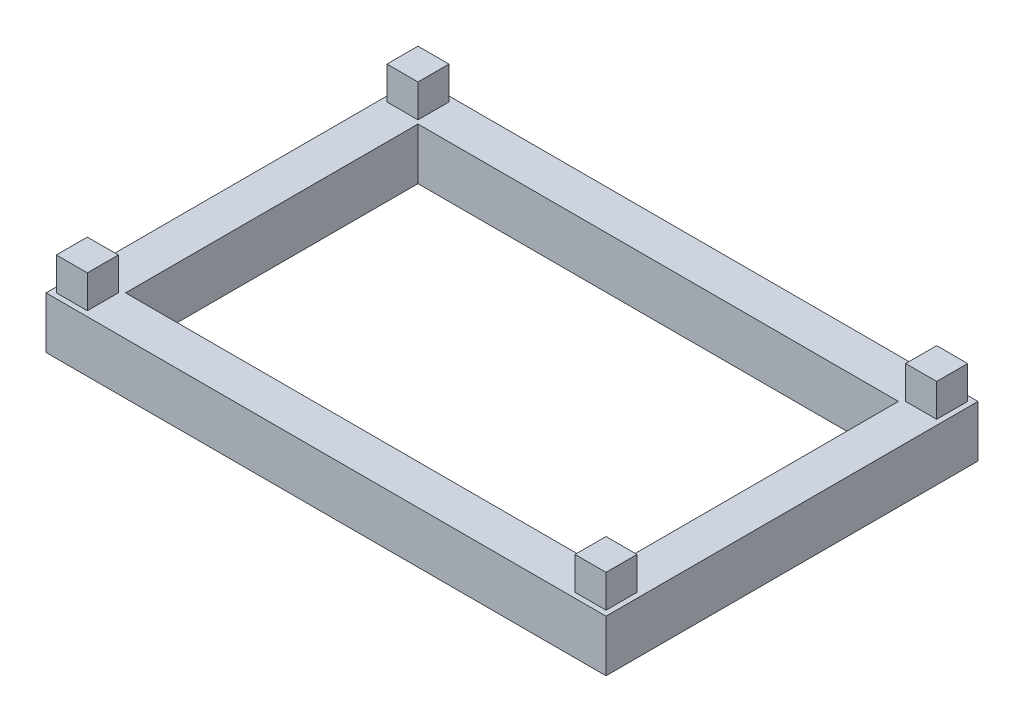
from build123d import *

# Parameters (mm, degrees)
SKETCH1_W           = 108.4
SKETCH1_H           = 72
BOSS_EXTRUDE1_DEPTH = 10
SKETCH2_W           = 93
SKETCH2_H           = 56.6
CUT_EXTRUDE1_DEPTH  = 131.516512365
SKETCH4_W           = 6
SKETCH4_H           = 6
BOSS_EXTRUDE2_DEPTH = 6.35
SKETCH5_W           = 6
SKETCH5_H           = 6
BOSS_EXTRUDE3_DEPTH = 6.35
SKETCH6_W           = 6
SKETCH6_H           = 6
BOSS_EXTRUDE4_DEPTH = 6.35
SKETCH7_W           = 6
SKETCH7_H           = 6
BOSS_EXTRUDE5_DEPTH = 6.35


with BuildPart() as part:
    # Sketch1 → Boss-Extrude1 (new body)
    with BuildSketch(Plane(origin=(0, 0, 0), x_dir=(1, 0, 0), z_dir=(0, 1, 0))):
        with Locations((54.2, 36)):
            Rectangle(SKETCH1_W, SKETCH1_H)
    extrude(amount=BOSS_EXTRUDE1_DEPTH)

    # Sketch2 → Cut-Extrude1 (cut, through all)
    with BuildSketch(Plane(origin=(0, 10, 0), x_dir=(1, 0, 0), z_dir=(0, 1, 0))):
        with Locations((54.2, 36)):
            Rectangle(SKETCH2_W, SKETCH2_H)
    extrude(amount=-CUT_EXTRUDE1_DEPTH, mode=Mode.SUBTRACT)

    # Sketch4 → Boss-Extrude2 (add)
    with BuildSketch(Plane(origin=(0, 10, 0), x_dir=(1, 0, 0), z_dir=(0, 1, 0))):
        with Locations((4, 4)):
            Rectangle(SKETCH4_W, SKETCH4_H)
    extrude(amount=BOSS_EXTRUDE2_DEPTH)

    # Sketch5 → Boss-Extrude3 (add)
    with BuildSketch(Plane(origin=(0, 10, 0), x_dir=(1, 0, 0), z_dir=(0, 1, 0))):
        with Locations((104.4, 4)):
            Rectangle(SKETCH5_W, SKETCH5_H)
    extrude(amount=BOSS_EXTRUDE3_DEPTH)

    # Sketch6 → Boss-Extrude4 (add)
    with BuildSketch(Plane(origin=(0, 10, 0), x_dir=(1, 0, 0), z_dir=(0, 1, 0))):
        with Locations((4, 68)):
            Rectangle(SKETCH6_W, SKETCH6_H)
    extrude(amount=BOSS_EXTRUDE4_DEPTH)

    # Sketch7 → Boss-Extrude5 (add)
    with BuildSketch(Plane(origin=(0, 10, 0), x_dir=(1, 0, 0), z_dir=(0, 1, 0))):
        with Locations((104.4, 68)):
            Rectangle(SKETCH7_W, SKETCH7_H)
    extrude(amount=BOSS_EXTRUDE5_DEPTH)


solid = part.part
